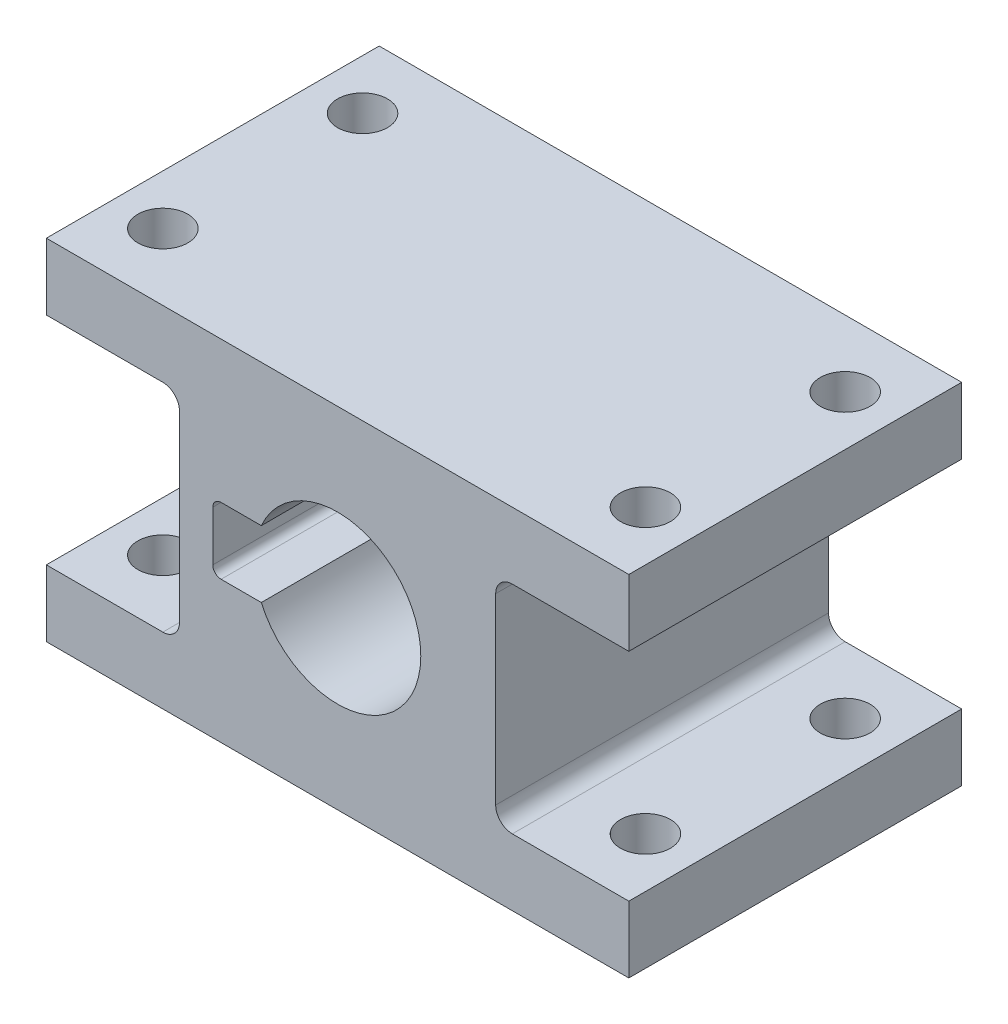
from build123d import *

# Parameters (mm, degrees)
SKETCH_1_W          = 35
SKETCH_1_H          = 21
EXTRUDE_1_DEPTH     = 20
SKETCH_2_R          = 5
CUT_EXTRUDE_1_DEPTH = 18
SKETCH_3_W          = 7.5
SKETCH_3_H          = 4
CUT_EXTRUDE_2_DEPTH = 18
FILLET_1_R          = 0.5
SKETCH_7_W          = 8
SKETCH_7_H          = 13
CUT_EXTRUDE_3_DEPTH = 29.574464124
FILLET_2_R          = 1
SKETCH_8_R          = 1.5
CUT_EXTRUDE_4_DEPTH = 34.871079109


with BuildPart() as part:
    # 草图1 → 凸台-拉伸1 (new body)
    with BuildSketch(Plane.XY):
        Rectangle(SKETCH_1_W, SKETCH_1_H)
    extrude(amount=EXTRUDE_1_DEPTH)

    # 草图2 → 切除-拉伸1 (cut)
    with BuildSketch(Plane.XY.offset(20)):
        Circle(SKETCH_2_R)
    extrude(amount=-CUT_EXTRUDE_1_DEPTH, mode=Mode.SUBTRACT)

    # 草图3 → 切除-拉伸2 (cut)
    with BuildSketch(Plane.XY.offset(20)):
        with Locations((-3.75, 0)):
            Rectangle(SKETCH_3_W, SKETCH_3_H)
    extrude(amount=-CUT_EXTRUDE_2_DEPTH, mode=Mode.SUBTRACT)

    # 圆角1
    fillet_1_edges = [part.edges().sort_by_distance(p)[0] for p in [
        (-7.5, 2, 11),
        (-7.5, -2, 11),
    ]]
    fillet(fillet_1_edges, radius=FILLET_1_R)

    # 草图7 → 切除-拉伸3 (cut, through all)
    with BuildSketch(Plane.XY.offset(20)):
        with Locations((-13.5, 0)):
            Rectangle(SKETCH_7_W, SKETCH_7_H)
        with Locations((13.5, 0)):
            Rectangle(SKETCH_7_W, SKETCH_7_H)
    extrude(amount=-CUT_EXTRUDE_3_DEPTH, mode=Mode.SUBTRACT)

    # 圆角2
    fillet_2_edges = [part.edges().sort_by_distance(p)[0] for p in [
        (-9.5, 6.5, 10),
        (-9.5, -6.5, 10),
        (9.5, 6.5, 10),
        (9.5, -6.5, 10),
    ]]
    fillet(fillet_2_edges, radius=FILLET_2_R)

    # 草图8 → 切除-拉伸4 (cut, through all)
    with BuildSketch(Plane(origin=(0, 10.5, 0), x_dir=(1, 0, 0), z_dir=(0, 1, 0))):
        with Locations(Location((-14.5, -4, 0), (0, 0, 270))):
            Circle(SKETCH_8_R)
        with Locations(Location((-14.5, -16, 0), (0, 0, 270))):
            Circle(SKETCH_8_R)
        with Locations(Location((14.5, -16, 0), (0, 0, 270))):
            Circle(SKETCH_8_R)
        with Locations(Location((14.5, -4, 0), (0, 0, 270))):
            Circle(SKETCH_8_R)
    extrude(amount=-CUT_EXTRUDE_4_DEPTH, mode=Mode.SUBTRACT)


solid = part.part
